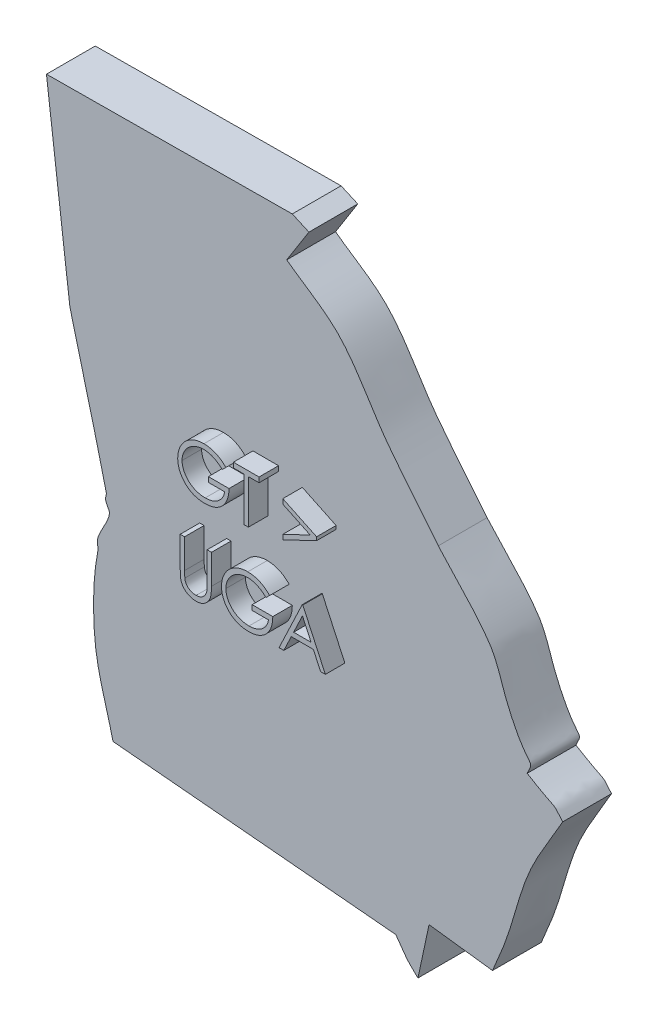
from build123d import *

# Parameters (mm, degrees)
BOSS_EXTRUDE1_DEPTH = 6.35
BOSS_EXTRUDE2_DEPTH = 2.54


with BuildPart() as part:
    # Sketch2 → Boss-Extrude1 (new body)
    with BuildSketch(Plane.XY):
        with BuildLine():
            Line((30.226641414, 85.789141414), (62.217171717, 86.029671717))
            Line((62.217171717, 86.029671717), (64.381944444, 85.067550505))
            Line((64.381944444, 85.067550505), (61.495580808, 80.497474747))
            add(Edge.make_bspline(
                [(61.495580808, 80.497474747), (63.793981481, 78.760311448), (66.427144916, 77.394185061), (68.390782828, 75.285984848), (70.836608377, 72.660098523), (72.415593171, 69.340561431), (74.564393939, 66.466540404), (76.693799073, 63.618461038), (79.000841751, 60.907617845), (81.219065657, 58.128156566)],
                knots=[0, 0, 0, 0, 1, 1, 1, 2, 2, 2, 3, 3, 3, 3], degree=3))
            add(Edge.make_bspline(
                [(81.219065657, 58.128156566), (83.43405564, 55.582753285), (85.966635155, 53.282131309), (87.864035606, 50.491946725), (88.983127155, 48.846288853), (89.39738697, 46.818925398), (90.159743807, 44.980619716), (92.894243028, 38.386797494), (93.902748638, 40.552970732), (92.787200649, 38.269640036)],
                knots=[0, 0, 0, 0, 1, 1, 1, 2, 2, 2, 3, 3, 3, 3], degree=3))
            add(Edge.make_bspline(
                [(92.787200649, 38.269640036), (97.091724226, 35.656699771), (95.82181171, 37.02445493), (97.414772727, 35.117424242)],
                knots=[0, 0, 0, 0, 1, 1, 1, 1], degree=3))
            add(Edge.make_bspline(
                [(97.414772727, 35.117424242), (95.971590909, 32.525042088), (94.266378275, 30.062060522), (93.085227273, 27.340277778), (91.79664482, 24.370935604), (91.121474105, 21.170298106), (90.038510101, 18.119949495), (89.517131472, 16.651399689), (88.862584175, 15.233585859), (88.274621212, 13.79040404)],
                knots=[0, 0, 0, 0, 1, 1, 1, 2, 2, 2, 3, 3, 3, 3], degree=3))
            Line((88.274621212, 13.79040404), (80.016414141, 14.83270202))
            Line((80.016414141, 14.83270202), (78.573232323, 8.097853535))
            add(Edge.make_bspline(
                [(78.573232323, 8.097853535), (78.118897306, 8.552188552), (77.622688742, 8.968196276), (77.210227273, 9.460858586), (76.657757091, 10.120753525), (76.194654882, 10.850589226), (75.686868687, 11.545454545)],
                knots=[0, 0, 0, 0, 1, 1, 1, 2, 2, 2, 2], degree=3))
            Line((75.686868687, 11.545454545), (38.885732323, 14.912878788))
            add(Edge.make_bspline(
                [(38.885732323, 14.912878788), (38.110690236, 18.253577441), (36.896524731, 21.522041057), (36.560606061, 24.934974747), (36.209573819, 28.501462324), (36.258664358, 32.164533912), (36.961489899, 35.678661616)],
                knots=[0, 0, 0, 0, 1, 1, 1, 2, 2, 2, 2], degree=3))
            Line((36.961489899, 35.678661616), (36.961489899, 35.919191919))
            add(Edge.make_bspline(
                [(36.961489899, 35.919191919), (36.93476431, 35.945917508), (36.881313131, 35.961572996), (36.881313131, 35.999368687), (36.881313131, 36.347827738), (36.843898456, 36.713648431), (36.961489899, 37.041666667), (37.357087631, 38.145176129), (38.167162058, 39.100774021), (38.404671717, 40.248737374), (38.507409454, 40.7453031), (38.009767919, 41.192209709), (37.923611111, 41.691919192), (37.873455646, 41.98282089), (38.072588391, 42.286799431), (38.003787879, 42.573863636), (36.51871957, 48.770183133), (34.85016835, 54.921085859), (33.273358586, 61.09469697)],
                knots=[0, 0, 0, 0, 1, 1, 1, 2, 2, 2, 3, 3, 3, 4, 4, 4, 5, 5, 5, 6, 6, 6, 6], degree=3))
            Line((33.273358586, 61.09469697), (30.226641414, 85.789141414))
        make_face()
    extrude(amount=BOSS_EXTRUDE1_DEPTH)

    # Sketch4 → Boss-Extrude2 (add)
    # profile 1 of 6: a face of its own
    with BuildSketch(Plane.XY.offset(6.35)):
        with BuildLine():
            Line((56.115642699, 55.6806343), (55.627181161, 55.217613467))
            add(Edge.make_bspline(
                [(55.627181161, 55.217613467), (55.538791178, 55.300763747), (55.364118922, 55.465081541), (55.079348196, 55.678280061), (54.782234175, 55.860917128), (54.474327216, 56.009518443), (54.163252411, 56.128087023), (53.853138774, 56.212502363), (53.547167287, 56.266336824), (53.343663905, 56.272774579), (53.24338709, 56.2759468)],
                knots=[0, 0, 0, 0, 1.08915593, 2.152340314, 3.188132944, 4.216796309, 5.218260357, 6.173443236, 7.099959455, 8, 8, 8, 8], degree=3))
            add(Edge.make_bspline(
                [(53.24338709, 56.2759468), (53.181856135, 56.275196401), (53.058953807, 56.273697549), (52.876396851, 56.25456733), (52.695754524, 56.227053933), (52.51736783, 56.187245098), (52.340889924, 56.136791519), (52.166934591, 56.07368075), (51.995177334, 56.000101949), (51.827236015, 55.915080033), (51.664421102, 55.821680883), (51.510647985, 55.718178531), (51.364936533, 55.607890298), (51.230025476, 55.488054949), (51.10513878, 55.359757979), (50.987303877, 55.225385981), (50.880665068, 55.081267799), (50.784342526, 54.93005502), (50.698415019, 54.774403477), (50.622562176, 54.615811338), (50.55888603, 54.454804631), (50.508504304, 54.291181319), (50.466937832, 54.126207248), (50.437695888, 53.958740113), (50.421209977, 53.788600598), (50.418358319, 53.674668429), (50.416924751, 53.617393114)],
                knots=[0, 0, 0, 0, 1.02818874, 2.053710826, 3.065248034, 4.081641283, 5.106893873, 6.131558223, 7.173050175, 8.228653731, 9.27666206, 10.308777013, 11.325269123, 12.329503258, 13.32196095, 14.316845687, 15.314881793, 16.315733098, 17.311955233, 18.285320748, 19.252783886, 20.203351036, 21.145449891, 22.095197417, 23.042428769, 24, 24, 24, 24], degree=3))
            add(Edge.make_bspline(
                [(50.416924751, 53.617393114), (50.418295839, 53.558844632), (50.421034273, 53.441907543), (50.438560853, 53.267384011), (50.471087803, 53.095452495), (50.514572075, 52.925548025), (50.568965841, 52.757379618), (50.636770535, 52.59167635), (50.717080982, 52.428444355), (50.810038726, 52.269154393), (50.911976552, 52.113991193), (51.026173285, 51.967833204), (51.147477486, 51.828734137), (51.280308419, 51.699782394), (51.420406731, 51.577528753), (51.571958146, 51.465341449), (51.73198261, 51.36105953), (51.900724266, 51.265997273), (52.076352171, 51.181073216), (52.256432281, 51.105555575), (52.441539889, 51.043363064), (52.630702197, 50.992675361), (52.823693705, 50.951127678), (53.021494032, 50.92439875), (53.222648803, 50.905002528), (53.358246036, 50.903584355), (53.426560167, 50.902869877)],
                knots=[0, 0, 0, 0, 0.93586088, 1.869166235, 2.799637598, 3.729985548, 4.670839027, 5.622275134, 6.589130586, 7.576015415, 8.568469353, 9.55398029, 10.53834874, 11.515998671, 12.510579167, 13.508179873, 14.527009472, 15.561807829, 16.601455013, 17.643573243, 18.680854198, 19.719860599, 20.772568776, 21.833555941, 22.908541556, 24, 24, 24, 24], degree=3))
            add(Edge.make_bspline(
                [(53.426560167, 50.902869877), (53.508889454, 50.904590866), (53.670556385, 50.907970306), (53.908203217, 50.934277974), (54.136445931, 50.975365728), (54.354643186, 51.035538141), (54.563048409, 51.112289094), (54.762425603, 51.204809295), (54.95120504, 51.316647417), (55.129954227, 51.44287429), (55.294613692, 51.583508343), (55.44312046, 51.735263283), (55.573105847, 51.89740249), (55.68650723, 52.06897099), (55.780321503, 52.251388901), (55.85732486, 52.443762264), (55.916349546, 52.646177607), (55.940579286, 52.786043853), (55.952822186, 52.856716031)],
                knots=[0, 0, 0, 0, 1.13008108, 2.219097802, 3.278683437, 4.311054135, 5.322181354, 6.324827112, 7.324222904, 8.330512327, 9.32562643, 10.293043162, 11.24128371, 12.174520618, 13.111833804, 14.052305215, 15.015860969, 16, 16, 16, 16], degree=3))
            Line((55.952822186, 52.856716031), (53.83615552, 52.856716031))
            Line((53.83615552, 52.856716031), (53.83615552, 53.507998082))
            Line((53.83615552, 53.507998082), (56.522693981, 53.507998082))
            add(Edge.make_bspline(
                [(56.522693981, 53.507998082), (56.519599085, 53.386608781), (56.513541814, 53.149027991), (56.47105321, 52.802553357), (56.402443252, 52.47530757), (56.308716686, 52.166945998), (56.18738582, 51.877905622), (56.039752804, 51.607892979), (55.863454813, 51.35865243), (55.664771584, 51.128149237), (55.441795946, 50.922537667), (55.200552878, 50.741824036), (54.940643807, 50.58960072), (54.662314585, 50.465756375), (54.36647637, 50.369102128), (54.052444595, 50.300573696), (53.72064512, 50.259516476), (53.493248577, 50.254270688), (53.376950792, 50.251587826)],
                knots=[0, 0, 0, 0, 1.140356446, 2.231883559, 3.274166699, 4.278491846, 5.25512956, 6.21435461, 7.1637429, 8.11826594, 9.068280886, 10.0076534, 10.945064095, 11.891975133, 12.864533718, 13.863980011, 14.907571808, 16, 16, 16, 16], degree=3))
            add(Edge.make_bspline(
                [(53.376950792, 50.251587826), (53.305268118, 50.252620374), (53.163886782, 50.254656893), (52.955078955, 50.26913008), (52.752028415, 50.291410554), (52.554764742, 50.325056707), (52.362562321, 50.36626758), (52.176381074, 50.419039198), (51.99551177, 50.480123838), (51.819674854, 50.549603132), (51.650466319, 50.630105994), (51.487132495, 50.719567769), (51.328770524, 50.817527152), (51.176459125, 50.925678258), (51.029404697, 51.04321215), (50.88855545, 51.170364403), (50.753122871, 51.306746291), (50.66828603, 51.403591066), (50.625538533, 51.452389108)],
                knots=[0, 0, 0, 0, 1.107784379, 2.184907829, 3.233506516, 4.263428166, 5.276301166, 6.270063455, 7.25232949, 8.225834625, 9.190232166, 10.146266622, 11.1027726, 12.066435141, 13.031522626, 14.010570082, 14.99756817, 16, 16, 16, 16], degree=3))
            add(Edge.make_bspline(
                [(50.625538533, 51.452389108), (50.563515485, 51.529805864), (50.440498907, 51.683354338), (50.282151395, 51.92937138), (50.147165992, 52.184100469), (50.037641515, 52.448250724), (49.952119559, 52.721575067), (49.890785357, 53.003724238), (49.854849275, 53.295061568), (49.849672143, 53.492211405), (49.847052956, 53.591952409)],
                knots=[0, 0, 0, 0, 1.023165419, 2.029347347, 3.013907458, 3.994755782, 4.975994455, 5.96558838, 6.970761222, 8, 8, 8, 8], degree=3))
            add(Edge.make_bspline(
                [(49.847052956, 53.591952409), (49.848018588, 53.666639753), (49.849937579, 53.815065211), (49.87320673, 54.035423469), (49.90659216, 54.25186901), (49.955663245, 54.464224905), (50.017523611, 54.672632979), (50.094727792, 54.877189999), (50.184616389, 55.078016681), (50.289092932, 55.273730698), (50.405360452, 55.46173499), (50.531544423, 55.641272719), (50.669436669, 55.809074308), (50.816785334, 55.96726487), (50.975348445, 56.113857064), (51.143640542, 56.250208093), (51.321791321, 56.376500859), (51.510361248, 56.490746131), (51.706535761, 56.593368699), (51.909844621, 56.683337698), (52.120225765, 56.757693141), (52.336103045, 56.820782713), (52.559110511, 56.867437325), (52.787629842, 56.901271478), (53.022852188, 56.924422851), (53.181848984, 56.926284772), (53.262467619, 56.927228852)],
                knots=[0, 0, 0, 0, 1.008945113, 2.00506715, 2.99143336, 3.967273523, 4.948097931, 5.927297278, 6.919902385, 7.919676788, 8.923139349, 9.905703106, 10.883022732, 11.856032218, 12.825136022, 13.798837087, 14.781400844, 15.773989409, 16.776158564, 17.77167057, 18.775803737, 19.789618931, 20.80898985, 21.851988756, 22.910860228, 24, 24, 24, 24], degree=3))
            add(Edge.make_bspline(
                [(53.262467619, 56.927228852), (53.328214147, 56.926177488), (53.458581786, 56.924092757), (53.652575614, 56.90964261), (53.843570941, 56.886739283), (54.031850962, 56.85548497), (54.216774512, 56.812915132), (54.398868392, 56.761973101), (54.578396565, 56.702660794), (54.754796389, 56.631923887), (54.929253959, 56.551635168), (55.102739298, 56.461259387), (55.274659645, 56.359251165), (55.44531314, 56.245307607), (55.61577591, 56.121385692), (55.783351761, 55.983941169), (55.952085675, 55.838394169), (56.060583252, 55.733742207), (56.115642699, 55.6806343)],
                knots=[0, 0, 0, 0, 0.985871117, 1.954866573, 2.915460327, 3.869826059, 4.81536089, 5.759505086, 6.70452669, 7.649098992, 8.607881297, 9.583363685, 10.581137262, 11.603961102, 12.659522466, 13.73993555, 14.853081303, 16, 16, 16, 16], degree=3))
        make_face()
    # profile 2 of 6: a face of its own
    with BuildSketch(Plane.XY.offset(6.35)):
        Polygon((57.092565776, 56.113126287), (57.092565776, 56.764408339), (60.430386289, 56.764408339), (60.430386289, 56.113126287), (59.04641193, 56.113126287), (59.04641193, 50.414408339), (58.476540135, 50.414408339), (58.476540135, 56.113126287), align=None)
    # profile 3 of 6: a face of its own
    with BuildSketch(Plane.XY.offset(6.35)):
        Polygon((63.523976033, 51.847992073), (67.088218821, 53.54870321), (63.523976033, 55.249414348), (63.523976033, 55.868895518), (67.920129879, 53.77130938), (67.920129879, 53.326097041), (63.523976033, 51.228510903), align=None)
    # profile 4 of 6: a face of its own
    with BuildSketch(Plane.XY.offset(6.35)):
        with BuildLine():
            Line((50.172693981, 45.181075005), (50.742565776, 45.181075005))
            Line((50.742565776, 45.181075005), (50.742565776, 41.376417553))
            add(Edge.make_bspline(
                [(50.742565776, 41.376417553), (50.742480969, 41.322568219), (50.742320034, 41.220379826), (50.743395023, 41.074931623), (50.746405591, 40.945623019), (50.748303624, 40.831955574), (50.752526072, 40.734450875), (50.755969671, 40.652580669), (50.760397538, 40.586732616), (50.765719051, 40.548304364), (50.768006481, 40.531786143)],
                knots=[0, 0, 0, 0, 1.528628734, 2.90083645, 4.128790002, 5.200304208, 6.127813768, 6.898992206, 7.526736466, 8, 8, 8, 8], degree=3))
            add(Edge.make_bspline(
                [(50.768006481, 40.531786143), (50.777399871, 40.47219273), (50.795657366, 40.356363778), (50.842187223, 40.191430181), (50.907170403, 40.042783107), (50.984174209, 39.90578405), (51.085651947, 39.784246211), (51.207215504, 39.672283641), (51.35449517, 39.574363367), (51.518253697, 39.484826894), (51.694756914, 39.412863102), (51.875117354, 39.358446569), (52.056623902, 39.325283423), (52.178137802, 39.321443416), (52.238479238, 39.319536544)],
                knots=[0, 0, 0, 0, 1.035780045, 2.013197591, 2.933192213, 3.817615948, 4.702609284, 5.640816605, 6.646850145, 7.73207398, 8.84249596, 9.914020372, 10.964143139, 12, 12, 12, 12], degree=3))
            add(Edge.make_bspline(
                [(52.238479238, 39.319536544), (52.290283881, 39.321484815), (52.393593958, 39.325370105), (52.547094196, 39.34943013), (52.696591536, 39.392792585), (52.842824198, 39.448744718), (52.97989527, 39.52267249), (53.107881229, 39.608072442), (53.222115795, 39.708240745), (53.32636102, 39.819094228), (53.417138689, 39.944170722), (53.495826332, 40.080746772), (53.560280519, 40.23087773), (53.592109485, 40.336386468), (53.608461209, 40.39059023)],
                knots=[0, 0, 0, 0, 0.994687771, 1.983630487, 2.973142513, 3.978332533, 4.983357753, 5.956394766, 6.925816176, 7.893390482, 8.871859704, 9.88551698, 10.913711441, 12, 12, 12, 12], degree=3))
            add(Edge.make_bspline(
                [(53.608461209, 40.39059023), (53.613904293, 40.412994072), (53.626033679, 40.46291886), (53.637367604, 40.547321773), (53.6491723, 40.646906762), (53.65736302, 40.762389337), (53.665348091, 40.89338253), (53.670125237, 41.04056874), (53.672333283, 41.203413512), (53.672991288, 41.31705522), (53.673335007, 41.376417553)],
                knots=[0, 0, 0, 0, 0.558680831, 1.244966039, 2.062412453, 2.990489873, 4.051219941, 5.244515665, 6.560634259, 8, 8, 8, 8], degree=3))
            Line((53.673335007, 41.376417553), (53.673335007, 45.181075005))
            Line((53.673335007, 45.181075005), (54.243206802, 45.181075005))
            Line((54.243206802, 45.181075005), (54.243206802, 41.345888707))
            add(Edge.make_bspline(
                [(54.243206802, 41.345888707), (54.242745755, 41.276767363), (54.241845994, 41.141872856), (54.234043519, 40.944203962), (54.221602962, 40.756692124), (54.204026003, 40.579312138), (54.180736011, 40.412698734), (54.154836683, 40.255391512), (54.121853815, 40.108519654), (54.083330359, 39.970937982), (54.039291208, 39.839972836), (53.982247981, 39.715678635), (53.917977817, 39.594276796), (53.841751233, 39.477603513), (53.756096295, 39.365142195), (53.659119675, 39.257574873), (53.554028697, 39.153182604), (53.439076353, 39.054643183), (53.316157543, 38.964276013), (53.185637906, 38.884814342), (53.048520052, 38.817642922), (52.905160409, 38.762350888), (52.755497798, 38.720777258), (52.599528445, 38.689798046), (52.436897337, 38.672195307), (52.326290033, 38.669579234), (52.270280119, 38.668254493)],
                knots=[0, 0, 0, 0, 1.316592851, 2.569410997, 3.76748051, 4.895814652, 5.963796859, 6.97159953, 7.931736103, 8.829262218, 9.692595152, 10.560224239, 11.431080259, 12.30701507, 13.211635791, 14.121146779, 15.063487852, 16.031507147, 17.00238618, 17.966455255, 18.938106653, 19.907068911, 20.888905087, 21.893141452, 22.933117798, 24, 24, 24, 24], degree=3))
            add(Edge.make_bspline(
                [(52.270280119, 38.668254493), (52.209194747, 38.669678281), (52.089345466, 38.672471749), (51.912746401, 38.688478738), (51.743447788, 38.718629254), (51.579661554, 38.757019437), (51.423617566, 38.809967075), (51.273225174, 38.871830816), (51.131060139, 38.947808131), (50.99481612, 39.032341858), (50.868134062, 39.12745513), (50.751843059, 39.231123732), (50.645751123, 39.341686988), (50.551646488, 39.460341937), (50.467970026, 39.586165748), (50.395888067, 39.719514369), (50.333996896, 39.860336171), (50.302053553, 39.958222692), (50.285905119, 40.007707618)],
                knots=[0, 0, 0, 0, 1.13879206, 2.234305948, 3.301075583, 4.341971843, 5.366689343, 6.369221514, 7.369726634, 8.367512178, 9.355451585, 10.318319045, 11.268648973, 12.207971039, 13.137398894, 14.081662264, 15.030215811, 16, 16, 16, 16], degree=3))
            add(Edge.make_bspline(
                [(50.285905119, 40.007707618), (50.276512275, 40.041512431), (50.256138987, 40.114835825), (50.234321661, 40.236187025), (50.215980899, 40.37591409), (50.1987351, 40.534026584), (50.188558848, 40.710647056), (50.179637209, 40.905698946), (50.172631129, 41.119418105), (50.172672445, 41.268288441), (50.172693981, 41.345888707)],
                knots=[0, 0, 0, 0, 0.625038921, 1.35572334, 2.194682327, 3.136881307, 4.189498639, 5.346923369, 6.617055217, 8, 8, 8, 8], degree=3))
            Line((50.172693981, 41.345888707), (50.172693981, 45.181075005))
        make_face()
    # profile 5 of 6: a face of its own
    with BuildSketch(Plane.XY.offset(6.35)):
        with BuildLine():
            Line((61.814360648, 44.097300967), (61.32589911, 43.634280134))
            add(Edge.make_bspline(
                [(61.32589911, 43.634280134), (61.237509127, 43.717430414), (61.062836871, 43.881748208), (60.778066145, 44.094946728), (60.480952123, 44.277583795), (60.173045165, 44.42618511), (59.86197036, 44.544753689), (59.551856723, 44.62916903), (59.245885236, 44.68300349), (59.042381854, 44.689441246), (58.942105039, 44.692613467)],
                knots=[0, 0, 0, 0, 1.08915593, 2.152340314, 3.188132944, 4.216796309, 5.218260357, 6.173443236, 7.099959455, 8, 8, 8, 8], degree=3))
            add(Edge.make_bspline(
                [(58.942105039, 44.692613467), (58.880574083, 44.691863068), (58.757671755, 44.690364215), (58.5751148, 44.671233996), (58.394472473, 44.6437206), (58.216085778, 44.603911765), (58.039607873, 44.553458185), (57.86565254, 44.490347416), (57.693895282, 44.416768616), (57.525953964, 44.331746699), (57.36313905, 44.238347549), (57.209365934, 44.134845197), (57.063654482, 44.024556964), (56.928743425, 43.904721616), (56.803856729, 43.776424646), (56.686021825, 43.642052648), (56.579383017, 43.497934465), (56.483060475, 43.346721687), (56.397132967, 43.191070143), (56.321280124, 43.032478005), (56.257603979, 42.871471297), (56.207222253, 42.707847985), (56.165655781, 42.542873915), (56.136413836, 42.375406779), (56.119927926, 42.205267264), (56.117076268, 42.091335096), (56.115642699, 42.034059781)],
                knots=[0, 0, 0, 0, 1.02818874, 2.053710826, 3.065248034, 4.081641283, 5.106893873, 6.131558223, 7.173050175, 8.228653731, 9.27666206, 10.308777013, 11.325269123, 12.329503258, 13.32196095, 14.316845687, 15.314881793, 16.315733098, 17.311955233, 18.285320748, 19.252783886, 20.203351036, 21.145449891, 22.095197417, 23.042428769, 24, 24, 24, 24], degree=3))
            add(Edge.make_bspline(
                [(56.115642699, 42.034059781), (56.117013788, 41.975511298), (56.119752222, 41.858574209), (56.137278802, 41.684050678), (56.169805752, 41.512119162), (56.213290024, 41.342214692), (56.26768379, 41.174046285), (56.335488484, 41.008343017), (56.41579893, 40.845111022), (56.508756675, 40.685821059), (56.610694501, 40.53065786), (56.724891234, 40.38449987), (56.846195435, 40.245400803), (56.979026368, 40.11644906), (57.11912468, 39.99419542), (57.270676095, 39.882008116), (57.430700559, 39.777726196), (57.599442215, 39.68266394), (57.77507012, 39.597739882), (57.955150229, 39.522222242), (58.140257838, 39.46002973), (58.329420146, 39.409342027), (58.522411653, 39.367794345), (58.720211981, 39.341065416), (58.921366752, 39.321669195), (59.056963984, 39.320251022), (59.125278116, 39.319536544)],
                knots=[0, 0, 0, 0, 0.93586088, 1.869166235, 2.799637598, 3.729985548, 4.670839027, 5.622275134, 6.589130586, 7.576015415, 8.568469353, 9.55398029, 10.53834874, 11.515998671, 12.510579167, 13.508179873, 14.527009472, 15.561807829, 16.601455013, 17.643573243, 18.680854198, 19.719860599, 20.772568776, 21.833555941, 22.908541556, 24, 24, 24, 24], degree=3))
            add(Edge.make_bspline(
                [(59.125278116, 39.319536544), (59.207607403, 39.321257532), (59.369274334, 39.324636973), (59.606921166, 39.350944641), (59.83516388, 39.392032395), (60.053361134, 39.452204807), (60.261766358, 39.528955761), (60.461143551, 39.621475962), (60.649922989, 39.733314083), (60.828672175, 39.859540956), (60.99333164, 40.00017501), (61.141838408, 40.15192995), (61.271823796, 40.314069156), (61.385225179, 40.485637657), (61.479039452, 40.668055567), (61.556042809, 40.860428931), (61.615067495, 41.062844274), (61.639297235, 41.20271052), (61.651540135, 41.273382698)],
                knots=[0, 0, 0, 0, 1.13008108, 2.219097802, 3.278683437, 4.311054135, 5.322181354, 6.324827112, 7.324222904, 8.330512327, 9.32562643, 10.293043162, 11.24128371, 12.174520618, 13.111833804, 14.052305215, 15.015860969, 16, 16, 16, 16], degree=3))
            Line((61.651540135, 41.273382698), (59.534873469, 41.273382698))
            Line((59.534873469, 41.273382698), (59.534873469, 41.924664749))
            Line((59.534873469, 41.924664749), (62.22141193, 41.924664749))
            add(Edge.make_bspline(
                [(62.22141193, 41.924664749), (62.218317034, 41.803275448), (62.212259763, 41.565694658), (62.169771158, 41.219220024), (62.1011612, 40.891974237), (62.007434635, 40.583612664), (61.886103769, 40.294572289), (61.738470753, 40.024559646), (61.562172762, 39.775319096), (61.363489532, 39.544815904), (61.140513895, 39.339204333), (60.899270827, 39.158490703), (60.639361756, 39.006267387), (60.361032534, 38.882423042), (60.065194319, 38.785768794), (59.751162544, 38.717240362), (59.419363068, 38.676183143), (59.191966526, 38.670937355), (59.075668741, 38.668254493)],
                knots=[0, 0, 0, 0, 1.140356446, 2.231883559, 3.274166699, 4.278491846, 5.25512956, 6.21435461, 7.1637429, 8.11826594, 9.068280886, 10.0076534, 10.945064095, 11.891975133, 12.864533718, 13.863980011, 14.907571808, 16, 16, 16, 16], degree=3))
            add(Edge.make_bspline(
                [(59.075668741, 38.668254493), (59.003986067, 38.669287041), (58.86260473, 38.67132356), (58.653796904, 38.685796747), (58.450746364, 38.708077221), (58.25348269, 38.741723374), (58.061280269, 38.782934246), (57.875099023, 38.835705865), (57.694229719, 38.896790505), (57.518392802, 38.966269798), (57.349184267, 39.046772661), (57.185850444, 39.136234436), (57.027488473, 39.234193819), (56.875177073, 39.342344924), (56.728122646, 39.459878816), (56.587273398, 39.587031069), (56.451840819, 39.723412958), (56.367003978, 39.820257733), (56.324256481, 39.869055775)],
                knots=[0, 0, 0, 0, 1.107784379, 2.184907829, 3.233506516, 4.263428166, 5.276301166, 6.270063455, 7.25232949, 8.225834625, 9.190232166, 10.146266622, 11.1027726, 12.066435141, 13.031522626, 14.010570082, 14.99756817, 16, 16, 16, 16], degree=3))
            add(Edge.make_bspline(
                [(56.324256481, 39.869055775), (56.262233433, 39.946472531), (56.139216856, 40.100021005), (55.980869343, 40.346038047), (55.845883941, 40.600767136), (55.736359464, 40.86491739), (55.650837507, 41.138241734), (55.589503306, 41.420390905), (55.553567224, 41.711728234), (55.548390092, 41.908878072), (55.545770904, 42.008619076)],
                knots=[0, 0, 0, 0, 1.023165419, 2.029347347, 3.013907458, 3.994755782, 4.975994455, 5.96558838, 6.970761222, 8, 8, 8, 8], degree=3))
            add(Edge.make_bspline(
                [(55.545770904, 42.008619076), (55.546736536, 42.08330642), (55.548655528, 42.231731878), (55.571924679, 42.452090136), (55.605310109, 42.668535677), (55.654381193, 42.880891572), (55.716241559, 43.089299646), (55.793445741, 43.293856666), (55.883334338, 43.494683347), (55.987810881, 43.690397365), (56.1040784, 43.878401657), (56.230262372, 44.057939386), (56.368154618, 44.225740975), (56.515503283, 44.383931537), (56.674066393, 44.530523731), (56.842358491, 44.66687476), (57.02050927, 44.793167526), (57.209079196, 44.907412797), (57.40525371, 45.010035366), (57.608562569, 45.100004364), (57.818943713, 45.174359808), (58.034820994, 45.23744938), (58.25782846, 45.284103992), (58.486347791, 45.317938144), (58.721570137, 45.341089518), (58.880566933, 45.342951439), (58.961185568, 45.343895518)],
                knots=[0, 0, 0, 0, 1.008945113, 2.00506715, 2.99143336, 3.967273523, 4.948097931, 5.927297278, 6.919902385, 7.919676788, 8.923139349, 9.905703106, 10.883022732, 11.856032218, 12.825136022, 13.798837087, 14.781400844, 15.773989409, 16.776158564, 17.77167057, 18.775803737, 19.789618931, 20.80898985, 21.851988756, 22.910860228, 24, 24, 24, 24], degree=3))
            add(Edge.make_bspline(
                [(58.961185568, 45.343895518), (59.026932096, 45.342844155), (59.157299734, 45.340759424), (59.351293563, 45.326309277), (59.542288889, 45.30340595), (59.730568911, 45.272151637), (59.915492461, 45.229581798), (60.097586341, 45.178639768), (60.277114514, 45.119327461), (60.453514337, 45.048590554), (60.627971908, 44.968301835), (60.801457247, 44.877926054), (60.973377593, 44.775917831), (61.144031088, 44.661974274), (61.314493859, 44.538052359), (61.48206971, 44.400607836), (61.650803623, 44.255060836), (61.759301201, 44.150408874), (61.814360648, 44.097300967)],
                knots=[0, 0, 0, 0, 0.985871117, 1.954866573, 2.915460327, 3.869826059, 4.81536089, 5.759505086, 6.70452669, 7.649098992, 8.607881297, 9.583363685, 10.581137262, 11.603961102, 12.659522466, 13.73993555, 14.853081303, 16, 16, 16, 16], degree=3))
        make_face()
    # profile 6 of 6: a face of its own
    with BuildSketch(Plane.XY.offset(6.35)):
        Polygon((66.129104238, 45.181075005), (69.059873469, 38.831075005), (68.440392299, 38.831075005), (67.501630279, 40.866331416), (64.623014494, 40.866331416), (63.657539735, 38.831075005), (63.035514494, 38.831075005), (66.047693981, 45.181075005), align=None)
        Polygon((66.082038933, 43.943384701), (64.932119061, 41.517613467), (67.201429959, 41.517613467), align=None, mode=Mode.SUBTRACT)
    extrude(amount=BOSS_EXTRUDE2_DEPTH)


solid = part.part
